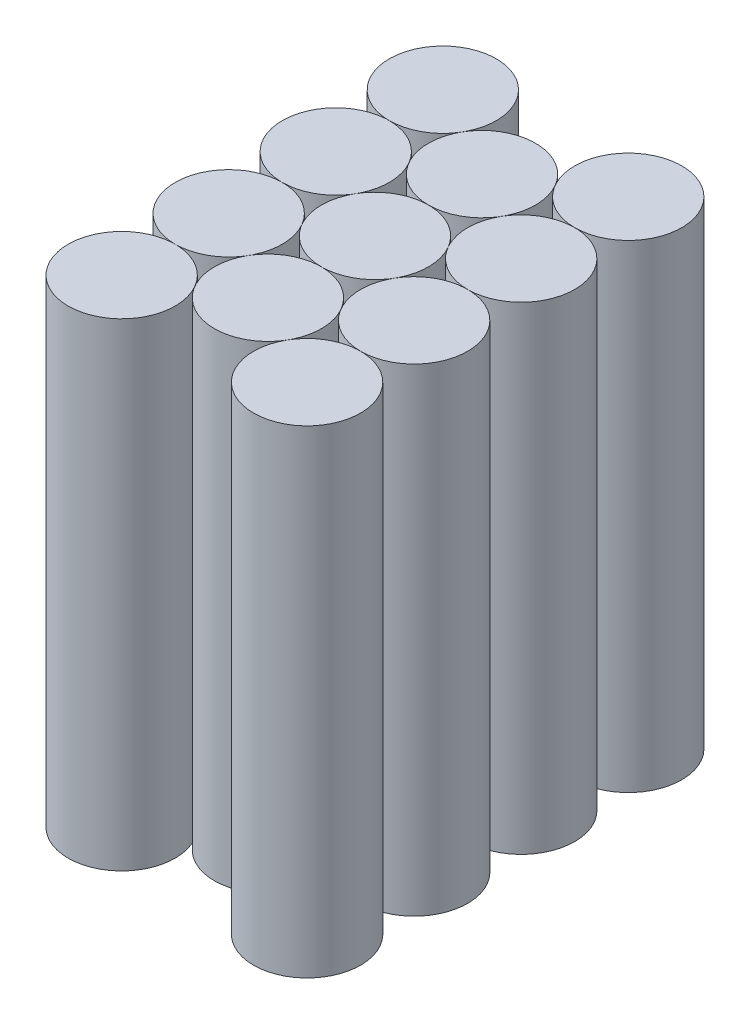
from build123d import *

# Parameters (mm, degrees)
SKETCH1_R              = 7.5
BOSS_EXTRUDE1_DEPTH    = 67
BOSS_EXTRUDE1_2_DEPTH  = 67
BOSS_EXTRUDE1_3_DEPTH  = 67
BOSS_EXTRUDE1_4_DEPTH  = 67
BOSS_EXTRUDE1_5_DEPTH  = 67
BOSS_EXTRUDE1_6_DEPTH  = 67
BOSS_EXTRUDE1_7_DEPTH  = 67
BOSS_EXTRUDE1_8_DEPTH  = 67
BOSS_EXTRUDE1_9_DEPTH  = 67
BOSS_EXTRUDE1_10_DEPTH = 67
BOSS_EXTRUDE1_11_DEPTH = 67


with BuildPart() as part:
    # Sketch1 → Boss-Extrude1 (new body)
    with BuildSketch(Plane(origin=(0, 0, 0), x_dir=(1, 0, 0), z_dir=(0, 1, 0))):
        with Locations(Location((0, 30, 0), (0, 0, 270))):
            Circle(SKETCH1_R)
    extrude(amount=BOSS_EXTRUDE1_DEPTH)


with BuildPart() as body_2:
    # Sketch1 → Boss-Extrude1 2 (new body)
    with BuildSketch(Plane(origin=(0, 0, 0), x_dir=(1, 0, 0), z_dir=(0, 1, 0))):
        with Locations(Location((0, 45, 0), (0, 0, 270))):
            Circle(SKETCH1_R)
    extrude(amount=BOSS_EXTRUDE1_2_DEPTH)


with BuildPart() as body_3:
    # Sketch1 → Boss-Extrude1 3 (new body)
    with BuildSketch(Plane(origin=(0, 0, 0), x_dir=(1, 0, 0), z_dir=(0, 1, 0))):
        with Locations(Location((0, 15, 0), (0, 0, 270))):
            Circle(SKETCH1_R)
    extrude(amount=BOSS_EXTRUDE1_3_DEPTH)


with BuildPart() as body_4:
    # Sketch1 → Boss-Extrude1 4 (new body)
    with BuildSketch(Plane(origin=(0, 0, 0), x_dir=(1, 0, 0), z_dir=(0, 1, 0))):
        with Locations(Location((-12.990381057, 7.5, 0), (0, 0, 270))):
            Circle(SKETCH1_R)
    extrude(amount=BOSS_EXTRUDE1_4_DEPTH)


with BuildPart() as body_5:
    # Sketch1 → Boss-Extrude1 5 (new body)
    with BuildSketch(Plane(origin=(0, 0, 0), x_dir=(1, 0, 0), z_dir=(0, 1, 0))):
        with Locations(Location((-12.990381057, 22.5, 0), (0, 0, 270))):
            Circle(SKETCH1_R)
    extrude(amount=BOSS_EXTRUDE1_5_DEPTH)


with BuildPart() as body_6:
    # Sketch1 → Boss-Extrude1 6 (new body)
    with BuildSketch(Plane(origin=(0, 0, 0), x_dir=(1, 0, 0), z_dir=(0, 1, 0))):
        with Locations(Location((-12.990381057, 37.5, 0), (0, 0, 270))):
            Circle(SKETCH1_R)
    extrude(amount=BOSS_EXTRUDE1_6_DEPTH)


with BuildPart() as body_7:
    # Sketch1 → Boss-Extrude1 7 (new body)
    with BuildSketch(Plane(origin=(0, 0, 0), x_dir=(1, 0, 0), z_dir=(0, 1, 0))):
        with Locations(Location((-12.990381057, 52.5, 0), (0, 0, 270))):
            Circle(SKETCH1_R)
    extrude(amount=BOSS_EXTRUDE1_7_DEPTH)


with BuildPart() as body_8:
    # Sketch1 → Boss-Extrude1 8 (new body)
    with BuildSketch(Plane(origin=(0, 0, 0), x_dir=(1, 0, 0), z_dir=(0, 1, 0))):
        with Locations(Location((12.990381057, 7.5, 0), (0, 0, 270))):
            Circle(SKETCH1_R)
    extrude(amount=BOSS_EXTRUDE1_8_DEPTH)


with BuildPart() as body_9:
    # Sketch1 → Boss-Extrude1 9 (new body)
    with BuildSketch(Plane(origin=(0, 0, 0), x_dir=(1, 0, 0), z_dir=(0, 1, 0))):
        with Locations(Location((12.990381057, 22.5, 0), (0, 0, 270))):
            Circle(SKETCH1_R)
    extrude(amount=BOSS_EXTRUDE1_9_DEPTH)


with BuildPart() as body_10:
    # Sketch1 → Boss-Extrude1 10 (new body)
    with BuildSketch(Plane(origin=(0, 0, 0), x_dir=(1, 0, 0), z_dir=(0, 1, 0))):
        with Locations(Location((12.990381057, 37.5, 0), (0, 0, 270))):
            Circle(SKETCH1_R)
    extrude(amount=BOSS_EXTRUDE1_10_DEPTH)


with BuildPart() as body_11:
    # Sketch1 → Boss-Extrude1 11 (new body)
    with BuildSketch(Plane(origin=(0, 0, 0), x_dir=(1, 0, 0), z_dir=(0, 1, 0))):
        with Locations(Location((12.990381057, 52.5, 0), (0, 0, 270))):
            Circle(SKETCH1_R)
    extrude(amount=BOSS_EXTRUDE1_11_DEPTH)


solid = Compound([part.part, body_2.part, body_3.part, body_4.part, body_5.part, body_6.part, body_7.part, body_8.part, body_9.part, body_10.part, body_11.part])
